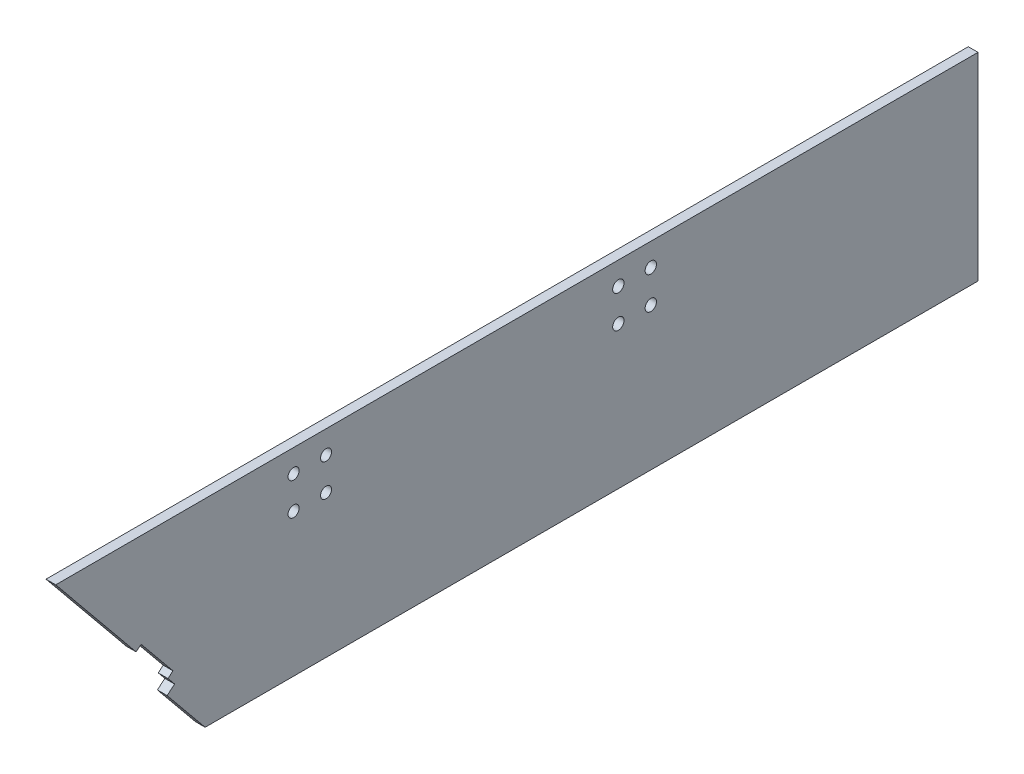
from build123d import *

# Parameters (mm, degrees)
SKETCH1_W                      = 3
SKETCH1_H                      = 76
BOSS_EXTRUDE1_DEPTH            = 220
M3_CLEARANCE_HOLE1_D           = 3.4
M3_CLEARANCE_HOLE1_CSINK_D     = 3.45
M3_CLEARANCE_HOLE1_CSINK_ANGLE = 90
SKETCH4_W                      = 220
SKETCH4_H                      = 15
CUT_EXTRUDE1_DEPTH             = 233.776717049
SKETCH5_R                      = 1.75
CUT_EXTRUDE2_DEPTH             = 233.776717049
BOSS_EXTRUDE2_START            = -3
SKETCH6_R                      = 1.725
SKETCH6_R_2                    = 1.7
BOSS_EXTRUDE2_DEPTH            = 3
BOSS_EXTRUDE3_DEPTH            = 3


with BuildPart() as part:
    # Sketch1 → Boss-Extrude1 (new body)
    with BuildSketch(Plane.XY):
        with Locations((1.5, 38)):
            Rectangle(SKETCH1_W, SKETCH1_H)
    extrude(amount=BOSS_EXTRUDE1_DEPTH)

    # M3 Clearance Hole1 (through all)
    with Locations(Plane.ZY):
        with Locations((50.754682085, 59), (60.754682085, 59), (60.754682085, 69), (50.754682085, 69), (200.754682085, 59), (200.754682085, 69), (210.754682085, 59), (210.754682085, 69)):
            CounterSinkHole(M3_CLEARANCE_HOLE1_D / 2, M3_CLEARANCE_HOLE1_CSINK_D / 2, counter_sink_angle=M3_CLEARANCE_HOLE1_CSINK_ANGLE)

    # Sketch4 → Cut-Extrude1 (cut, through all)
    with BuildSketch(Plane.ZY):
        with Locations((110, 7.5)):
            Rectangle(SKETCH4_W, SKETCH4_H)
    extrude(amount=-CUT_EXTRUDE1_DEPTH, mode=Mode.SUBTRACT)

    # Sketch5 → Cut-Extrude2 (cut, through all)
    with BuildSketch(Plane.ZY):
        with Locations((110.754682085, 69)):
            Circle(SKETCH5_R)
        with Locations((100.754682085, 69)):
            Circle(SKETCH5_R)
        with Locations((100.754682085, 59)):
            Circle(SKETCH5_R)
        with Locations((110.754682085, 59)):
            Circle(SKETCH5_R)
    extrude(amount=-CUT_EXTRUDE2_DEPTH, mode=Mode.SUBTRACT)

    # Sketch6 → Boss-Extrude2 (add)
    with BuildSketch(Plane.ZY.offset(BOSS_EXTRUDE2_START)):
        with Locations((50.754682085, 59)):
            Circle(SKETCH6_R)
        with Locations((60.754682085, 59)):
            Circle(SKETCH6_R_2)
        with Locations((60.754682085, 69)):
            Circle(SKETCH6_R)
        with Locations((50.754682085, 69)):
            Circle(SKETCH6_R)
    extrude(amount=BOSS_EXTRUDE2_DEPTH)

    # Sketch7 → Boss-Extrude3 (add)
    with BuildSketch(Plane.ZY):
        Polygon((220, 76), (284, 76), (259.255982343, 45.736716068), (257.707645299, 47.00267515), (247.896462411, 35.003063059), (249.444799455, 33.737103977), (247.387615946, 31.22105628), (249.710121512, 29.322117657), (238, 15), (220, 15), align=None)
    extrude(amount=-BOSS_EXTRUDE3_DEPTH)


solid = part.part
